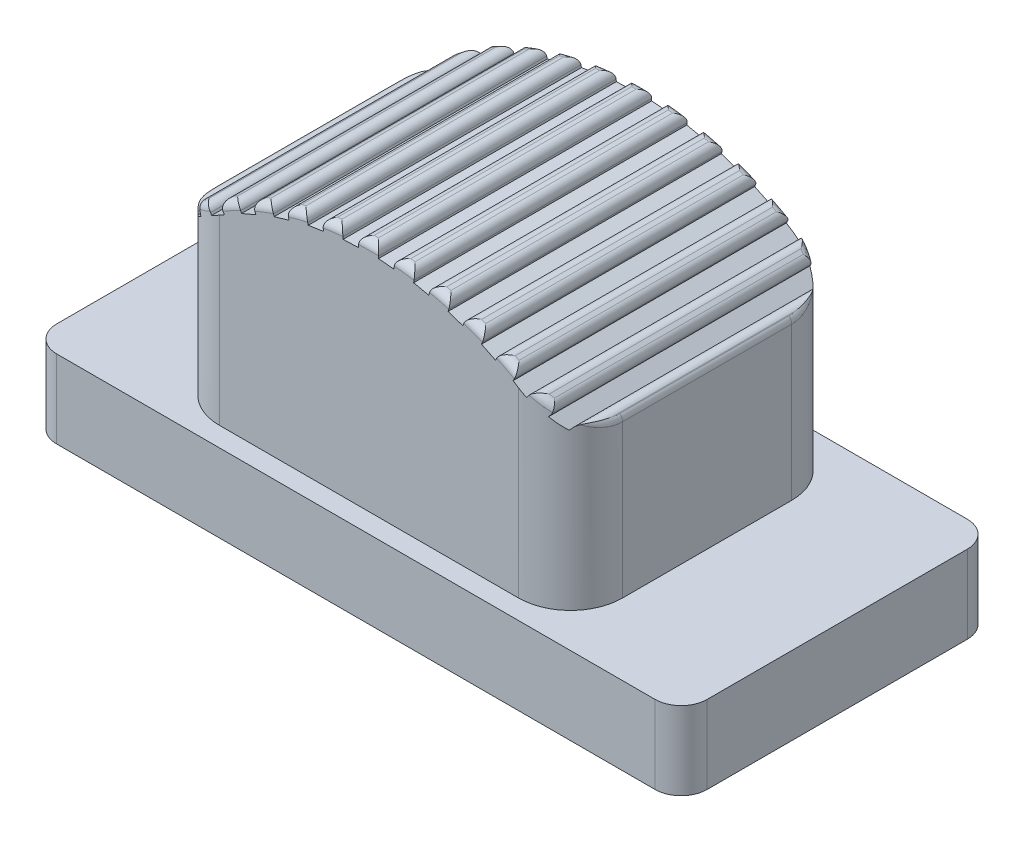
from build123d import *

# Parameters (mm, degrees)
SKETCH1_W           = 25
SKETCH1_H           = 12
BOSS_EXTRUDE1_DEPTH = 3
SKETCH2_W           = 6.3
SKETCH2_H           = 5
CUT_EXTRUDE1_DEPTH  = 15.186260959
SKETCH4_W           = 2.2
SKETCH4_H           = 10.5
SKETCH4_W_2         = 13.3
SKETCH4_W_3         = 6.3
SKETCH4_H_2         = 5
BOSS_EXTRUDE2_DEPTH = 6
BOSS_EXTRUDE3_DEPTH = 10.5
CUT_EXTRUDE2_DEPTH  = 21.659440941
CIRPATTERN1_COUNT   = 12
CIRPATTERN1_ANGLE   = 77
FILLET1_R           = 2
FILLET2_R           = 1
FILLET3_R           = 0.3
FILLET4_R           = 0.6


with BuildPart() as part:
    # Sketch1 → Boss-Extrude1 (new body)
    with BuildSketch(Plane(origin=(0, 0, 0), x_dir=(1, 0, 0), z_dir=(0, 1, 0))):
        Rectangle(SKETCH1_W, SKETCH1_H)
    extrude(amount=BOSS_EXTRUDE1_DEPTH)

    # Sketch2 → Cut-Extrude1 (cut, through all)
    with BuildSketch(Plane(origin=(0, 3, 0), x_dir=(1, 0, 0), z_dir=(0, 1, 0))):
        with Locations((0.85, 0)):
            Rectangle(SKETCH2_W, SKETCH2_H)
    extrude(amount=-CUT_EXTRUDE1_DEPTH, mode=Mode.SUBTRACT)

    # Sketch4 → Boss-Extrude2 (add)
    # profile 1 of 2: a face of its own
    with BuildSketch(Plane(origin=(0, 3, 0), x_dir=(1, 0, 0), z_dir=(0, 1, 0))):
        with Locations((-6.9, 0)):
            Rectangle(SKETCH4_W, SKETCH4_H)
    # profile 2 of 2: a face of its own
    with BuildSketch(Plane(origin=(0, 3, 0), x_dir=(1, 0, 0), z_dir=(0, 1, 0))):
        with Locations((0.85, 0)):
            Rectangle(SKETCH4_W_2, SKETCH4_H)
        with Locations((0.85, 0)):
            Rectangle(SKETCH4_W_3, SKETCH4_H_2, mode=Mode.SUBTRACT)
    extrude(amount=BOSS_EXTRUDE2_DEPTH)

    # Sketch5 → Boss-Extrude3 (add)
    with BuildSketch(Plane.XY.offset(5.25)):
        with BuildLine():
            Line((-8, 9), (7.5, 9))
            ThreePointArc((7.5, 9), (-0.25, 12), (-8, 9))
        make_face()
    extrude(amount=-BOSS_EXTRUDE3_DEPTH)

    # Sketch6 → Cut-Extrude2 (cut, through all)
    with BuildSketch(Plane(origin=(0, 0, -5.25), x_dir=(-1, 0, 0), z_dir=(0, 0, -1))):
        with BuildLine():
            ThreePointArc((-6.660242481, 9.694920953), (-6.906105283, 9.505117096), (-7.146757278, 9.308748465))
            Line((-7.146757278, 9.308748465), (-6.88710837, 8.999168671))
            Line((-6.88710837, 8.999168671), (-6.427394423, 9.384737195))
            Line((-6.427394423, 9.384737195), (-6.660242481, 9.694920953))
        make_face()
    cut_extrude2 = extrude(amount=-CUT_EXTRUDE2_DEPTH, mode=Mode.SUBTRACT)

    # CirPattern1: Cut-Extrude2 ×12 about axis
    cirpattern1_axis = Axis((-0.25, 0.489583333, 0), (0, 0, 1))
    for i in range(1, CIRPATTERN1_COUNT):
        add(cut_extrude2.rotate(cirpattern1_axis, i * CIRPATTERN1_ANGLE / (CIRPATTERN1_COUNT - 1)), mode=Mode.SUBTRACT)

    # Fillet1
    fillet1_edges = [part.edges().sort_by_distance(p)[0] for p in [
        (7.5, 6, 5.25),
        (-8, 6, 5.25),
        (7.5, 6, -5.25),
        (-8, 6, -5.25),
    ]]
    fillet(fillet1_edges, radius=FILLET1_R)

    # Fillet2
    fillet2_edges = [part.edges().sort_by_distance(p)[0] for p in [
        (12.5, 1.5, 6),
        (-12.5, 1.5, 6),
        (-12.5, 1.5, -6),
        (12.5, 1.5, -6),
    ]]
    fillet(fillet2_edges, radius=FILLET2_R)

    # Fillet3
    fillet3_edges = [part.edges().sort_by_distance(p)[0] for p in [
        (-7.90975005, 9.081318951, -3.844015751),
        (-7.664939081, 9.29346715, 0),
        (-7.909750055, 9.081318948, 3.844015753),
        (-8, 9, 0),
        (-6.871315691, 9.904883127, -5.050224723),
        (-6.53674571, 10.131498092, 0),
        (-6.871315692, 9.904883135, 5.050224711),
        (-7.179222152, 9.680642696, 0),
        (-5.664295744, 10.64709747, 5.25),
        (-5.664295744, 10.64709747, -5.25),
        (-6.007464411, 10.456593687, 0),
        (-5.31483144, 10.825790294, 0),
        (-4.386048826, 11.231221567, 5.25),
        (-4.386048826, 11.231221567, -5.25),
        (-4.749876137, 11.083959511, 0),
        (-4.017412199, 11.365993456, 0),
        (-1.664553016, 11.912749777, 5.25),
        (-1.664553016, 11.912749777, -5.25),
        (-2.053199017, 11.857879826, 0),
        (-1.274262201, 11.954337094, 0),
        (-3.046142947, 11.655212579, 5.25),
        (-3.046142947, 11.655212579, -5.25),
        (-3.425205074, 11.553387588, 0),
        (-2.663829519, 11.744054396, 0),
        (-0.261875358, 11.999993874, 5.25),
        (-0.261875358, 11.999993874, -5.25),
        (-0.654311415, 11.992896948, 0),
        (0.130574507, 11.99370672, 0),
        (1.140979334, 11.915644261, 5.25),
        (1.140979334, 11.915644261, -5.25),
        (0.750603538, 11.95642616, 0),
        (1.529737726, 11.861576363, 0),
        (7.404537686, 9.085963078, -3.860521266),
        (7.5, 9, 0),
        (7.404537686, 9.085963078, 3.860521266),
        (7.146757278, 9.308748465, 0),
        (6.351576995, 9.918733501, -5.059645463),
        (6.660242481, 9.694920953, 0),
        (6.351576995, 9.918733501, 5.059645463),
        (6.016837107, 10.144449698, 0),
        (5.143325106, 10.658247756, 5.25),
        (5.143325106, 10.658247756, -5.25),
        (4.793492829, 10.836219111, 0),
        (5.48688613, 10.468452477, 0),
        (3.863875622, 11.239733063, 5.25),
        (3.863875622, 11.239733063, -5.25),
        (3.494961689, 11.373744017, 0),
        (4.22800602, 11.093222045, 0),
        (2.523097728, 11.660958398, 5.25),
        (2.523097728, 11.660958398, -5.25),
        (2.140601797, 11.749011156, 0),
        (2.902369155, 11.559915783, 0),
    ]]
    fillet(fillet3_edges, radius=FILLET3_R)

    # Fillet4
    fillet4_edges = [part.edges().sort_by_distance(p)[0] for p in [
        (-2.3, 0, 0),
        (0.85, 0, -2.5),
        (4, 0, 0),
        (0.85, 0, 2.5),
    ]]
    fillet(fillet4_edges, radius=FILLET4_R)


solid = part.part
